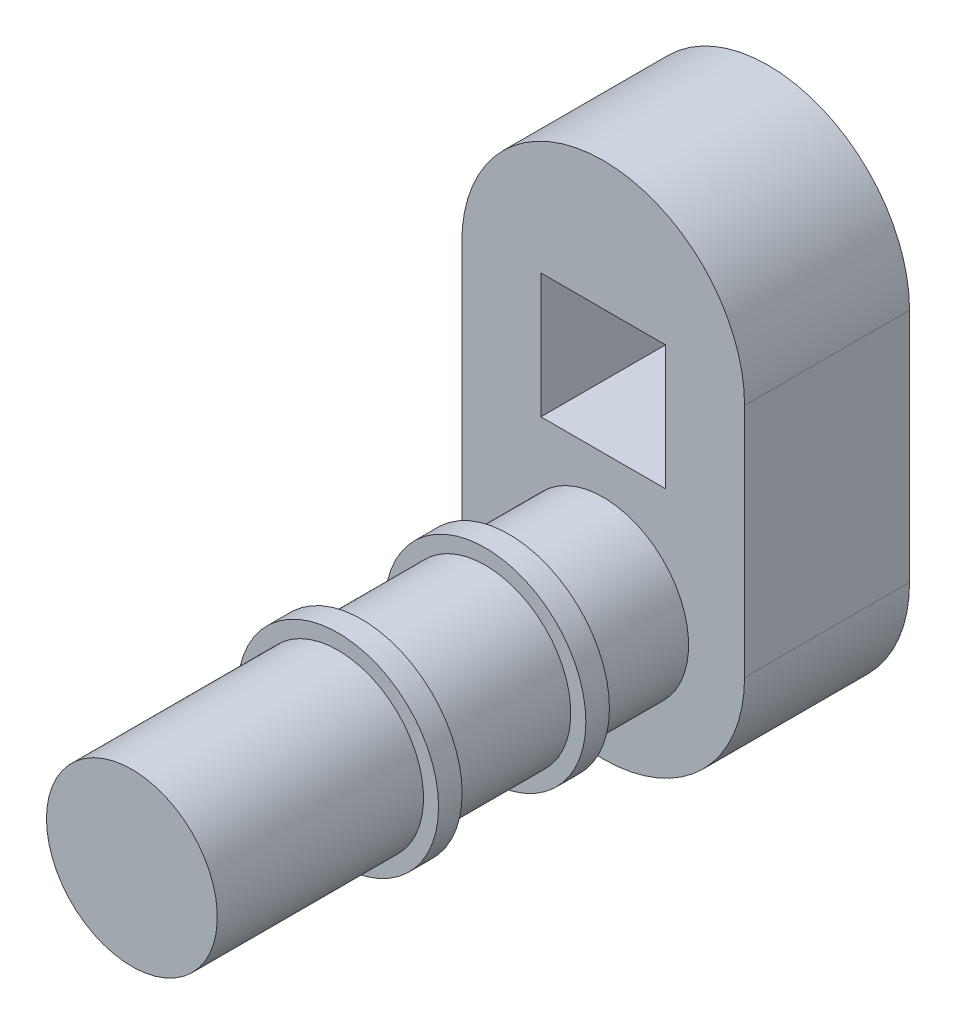
from build123d import *

# Parameters (mm, degrees)
SKETCH1_W           = 5.288
SKETCH1_H           = 5.288
BOSS_EXTRUDE1_DEPTH = 7
FILLET1_R           = 1


with BuildPart() as part:
    # Sketch1 → Boss-Extrude1 (new body)
    with BuildSketch(Plane.XY):
        with BuildLine():
            Line((6, 0), (6, -10))
            ThreePointArc((6, -10), (0, -16), (-6, -10))
            Line((-6, -10), (-6, 0))
            ThreePointArc((-6, 0), (0, 6), (6, 0))
        make_face()
        with Locations((0, -2.1)):
            Rectangle(SKETCH1_W, SKETCH1_H, mode=Mode.SUBTRACT)
    extrude(amount=BOSS_EXTRUDE1_DEPTH)

    # Sketch4 → Revolve1 (revolve)
    with BuildSketch(Plane(origin=(0, 0, 0), x_dir=(0, 0, -1), z_dir=(1, 0, 0)), mode=Mode.PRIVATE) as revolve1_sk:
        Polygon((-7, -13.625), (-11, -13.625), (-11, -14.264510891), (-12, -14.264510891), (-12, -13.625), (-17.25, -13.625), (-17.25, -14.264510891), (-18.25, -14.264510891), (-18.25, -13.625), (-27, -13.625), (-27, -10), (-7, -10), align=None)
    revolve(revolve1_sk.sketch.rotate(Axis((0, -10, 7), (0, 0, 1)), 270), axis=Axis((0, -10, 7), (0, 0, 1)))

    # Fillet1
    fillet1_edges = [part.edges().sort_by_distance(p)[0] for p in [
        (2.644, -2.1, 0),
        (0, 0.544, 0),
        (-2.644, -2.1, 0),
        (0, -4.744, 0),
    ]]
    fillet(fillet1_edges, radius=FILLET1_R)


solid = part.part
